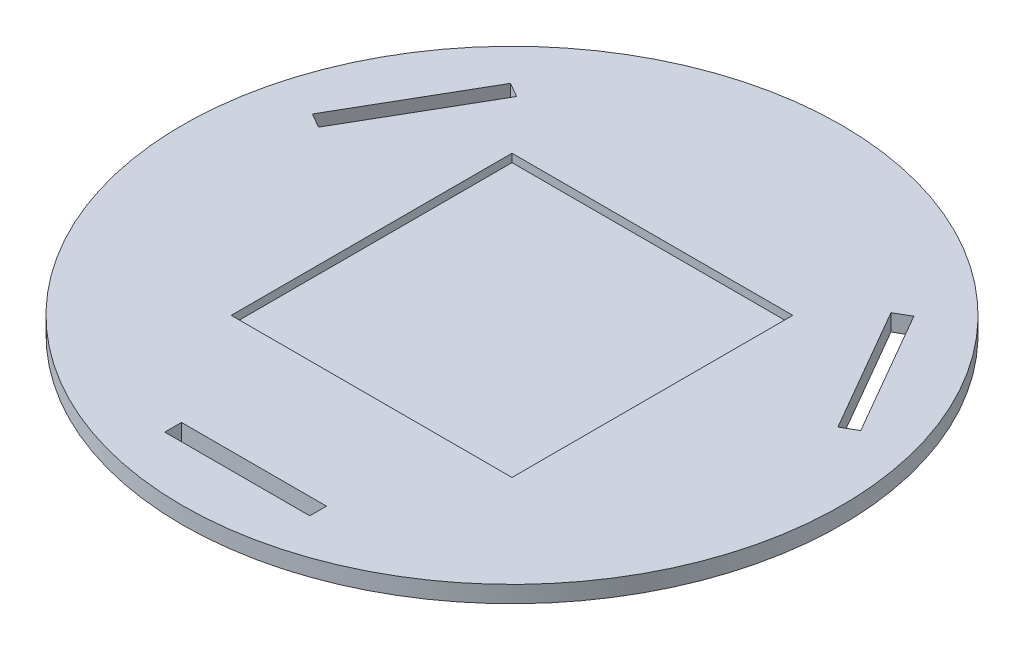
from build123d import *

# Parameters (mm, degrees)
SKETCH1_R           = 125
BOSS_EXTRUDE1_DEPTH = 6.35
SKETCH3_W           = 55
SKETCH3_H           = 6.35
CUT_EXTRUDE1_DEPTH  = 177.890707783
SKETCH4_W           = 106.5
SKETCH4_H           = 106.5
CUT_EXTRUDE2_DEPTH  = 3.1


with BuildPart() as part:
    # Sketch1 → Boss-Extrude1 (new body)
    with BuildSketch(Plane(origin=(0, 0, 0), x_dir=(1, 0, 0), z_dir=(0, 1, 0))):
        Circle(SKETCH1_R)
    extrude(amount=BOSS_EXTRUDE1_DEPTH)

    # Sketch3 → Cut-Extrude1 (cut, through all)
    with BuildSketch(Plane(origin=(0, 6.35, 0), x_dir=(1, 0, 0), z_dir=(0, 1, 0))):
        Polygon((-98.500369343, 25.11494995), (-103.999630657, 28.28994995), (-76.499630657, 75.921347158), (-71.000369343, 72.746347158), align=None)
        Polygon((71.000369343, 72.746347158), (98.500369343, 25.11494995), (103.999630657, 28.28994995), (76.499630657, 75.921347158), align=None)
        with Locations((0, -101.036297108)):
            Rectangle(SKETCH3_W, SKETCH3_H)
    extrude(amount=-CUT_EXTRUDE1_DEPTH, mode=Mode.SUBTRACT)

    # Sketch4 → Cut-Extrude2 (cut)
    with BuildSketch(Plane(origin=(0, 6.35, 0), x_dir=(1, 0, 0), z_dir=(0, 1, 0))):
        Rectangle(SKETCH4_W, SKETCH4_H)
    extrude(amount=-CUT_EXTRUDE2_DEPTH, mode=Mode.SUBTRACT)


solid = part.part
